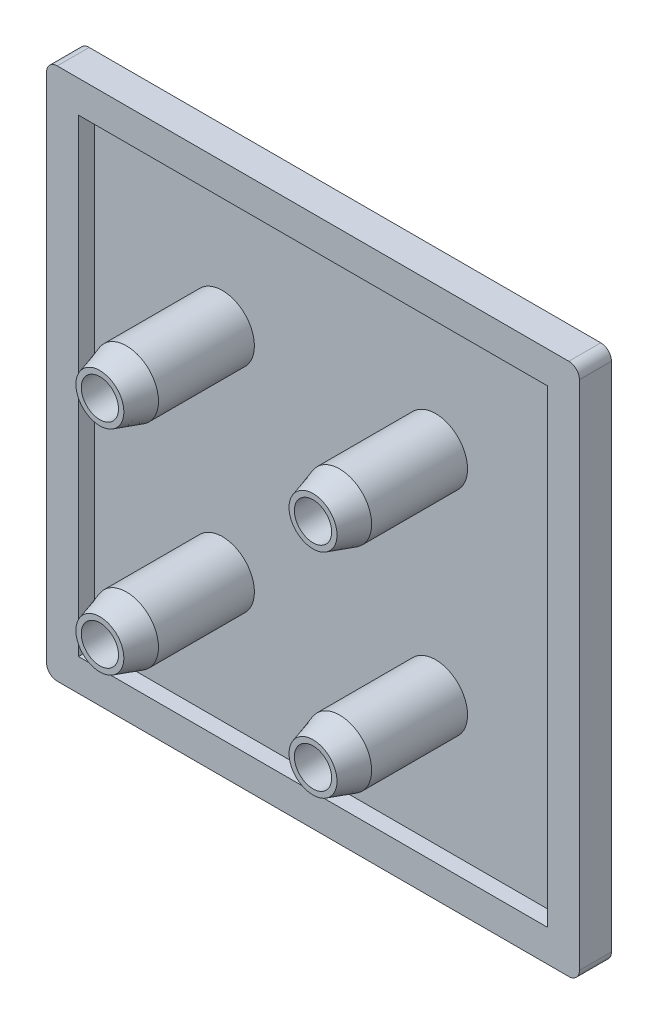
from build123d import *

# Parameters (mm, degrees)
BOSS_EXTRUDE1_DEPTH = 3
SKETCH2_W           = 44
SKETCH2_H           = 44
CUT_EXTRUDE1_DEPTH  = 1.5


with BuildPart() as part:
    # Sketch1 → Boss-Extrude1 (new body)
    with BuildSketch(Plane.XY):
        with BuildLine():
            Line((-25, 24), (-25, -24))
            ThreePointArc((-25, -24), (-24.707106781, -24.707106781), (-24, -25))
            Line((-24, -25), (24, -25))
            ThreePointArc((24, -25), (24.707106781, -24.707106781), (25, -24))
            Line((25, -24), (25, 24))
            ThreePointArc((25, 24), (24.707106781, 24.707106781), (24, 25))
            Line((24, 25), (-24, 25))
            ThreePointArc((-24, 25), (-24.707106781, 24.707106781), (-25, 24))
        make_face()
    extrude(amount=-BOSS_EXTRUDE1_DEPTH)

    # Sketch2 → Cut-Extrude1 (cut)
    with BuildSketch(Plane.XY):
        Rectangle(SKETCH2_W, SKETCH2_H)
    extrude(amount=-CUT_EXTRUDE1_DEPTH, mode=Mode.SUBTRACT)

    # Sketch3 → Revolve1 (revolve)
    with BuildSketch(Plane(origin=(-10, 0, 0), x_dir=(0, 0, -1), z_dir=(1, 0, 0)), mode=Mode.PRIVATE) as revolve1_sk:
        Polygon((0, 10), (0, 11.75), (-10, 11.75), (-10, 12.25), (-7.5, 13), (1.5, 13), (1.5, 10), align=None)
    revolve(revolve1_sk.sketch.rotate(Axis((-10, 10, -1.5), (0, 0, 1)), 270), axis=Axis((-10, 10, -1.5), (0, 0, 1)))

    # Sketch4 → Revolve2 (revolve)
    with BuildSketch(Plane(origin=(10, 0, 0), x_dir=(0, 0, -1), z_dir=(1, 0, 0)), mode=Mode.PRIVATE) as revolve2_sk:
        Polygon((0, 10), (0, 11.75), (-10, 11.75), (-10, 12.25), (-7.5, 13), (1.5, 13), (1.5, 10), align=None)
    revolve(revolve2_sk.sketch.rotate(Axis((10, 10, -1.5), (0, 0, 1)), 270), axis=Axis((10, 10, -1.5), (0, 0, 1)))

    # Sketch5 → Revolve3 (revolve)
    with BuildSketch(Plane(origin=(10, 0, 0), x_dir=(0, 0, -1), z_dir=(1, 0, 0)), mode=Mode.PRIVATE) as revolve3_sk:
        Polygon((0, -10), (0, -8.25), (-10, -8.25), (-10, -7.75), (-7.5, -7), (1.5, -7), (1.5, -10), align=None)
    revolve(revolve3_sk.sketch.rotate(Axis((10, -10, -1.5), (0, 0, 1)), 270), axis=Axis((10, -10, -1.5), (0, 0, 1)))

    # Sketch6 → Revolve4 (revolve)
    with BuildSketch(Plane(origin=(-10, 0, 0), x_dir=(0, 0, -1), z_dir=(1, 0, 0)), mode=Mode.PRIVATE) as revolve4_sk:
        Polygon((0, -10), (0, -8.25), (-10, -8.25), (-10, -7.75), (-7.5, -7), (1.5, -7), (1.5, -10), align=None)
    revolve(revolve4_sk.sketch.rotate(Axis((-10, -10, -1.5), (0, 0, 1)), 270), axis=Axis((-10, -10, -1.5), (0, 0, 1)))


solid = part.part
